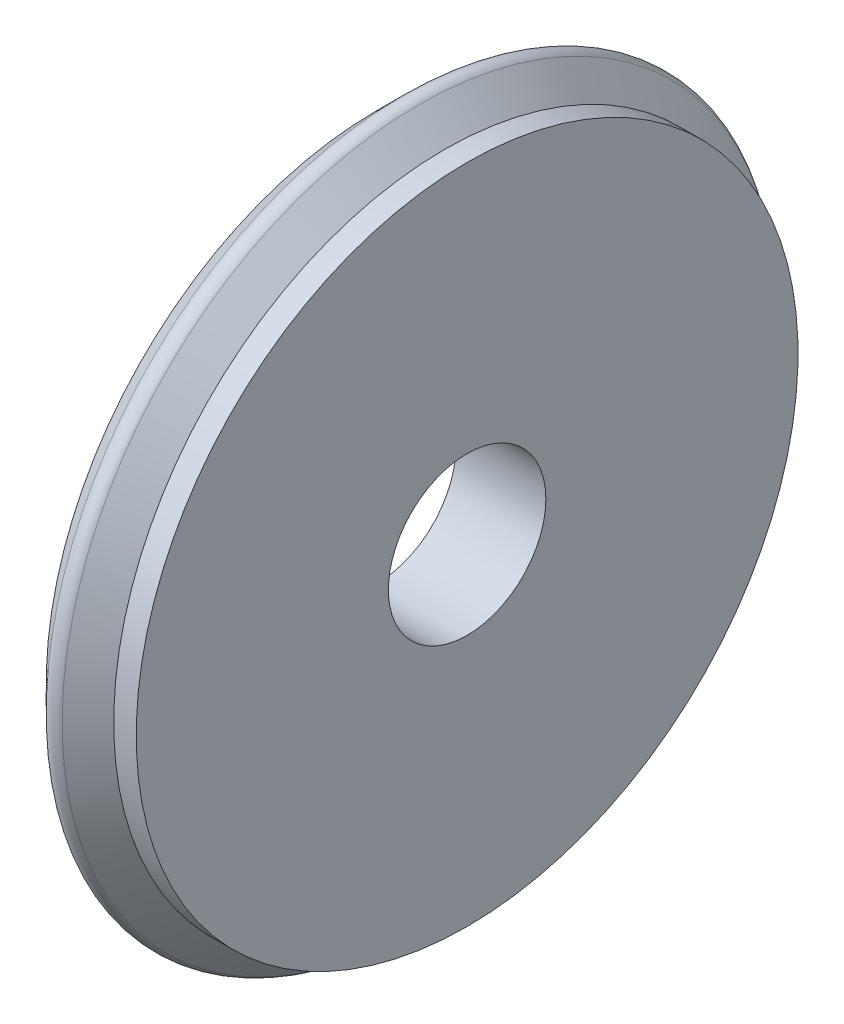
from build123d import *

# Parameters (mm, degrees)
ESQUISSE6_W = 4
ESQUISSE6_H = 3.5


with BuildPart() as part:
    # Esquisse1 → Révolution1 (revolve)
    with BuildSketch(Plane.XY, mode=Mode.PRIVATE) as r_volution1_sk:
        with BuildLine():
            Line((0, 0), (0, 14.707106781))
            Line((0, 14.707106781), (1.146446609, 15.853553391))
            ThreePointArc((1.146446609, 15.853553391), (1.5, 16), (1.853553391, 15.853553391))
            Line((1.853553391, 15.853553391), (3, 14.707106781))
            Line((3, 14.707106781), (4, 14.707106781))
            Line((4, 14.707106781), (4, 0))
            Line((4, 0), (0, 0))
        make_face()
    revolve(r_volution1_sk.sketch.rotate(Axis((0, 0, 0), (1, 0, 0)), 180), axis=Axis((0, 0, 0), (1, 0, 0)))

    # Esquisse6 → Enlèvement de matière-Révolution1 (revolve, cut)
    with BuildSketch(Plane.XY, mode=Mode.PRIVATE) as enl_vement_de_mati_re_r_volution1_sk:
        with Locations((2, 1.75)):
            Rectangle(ESQUISSE6_W, ESQUISSE6_H)
    revolve(enl_vement_de_mati_re_r_volution1_sk.sketch.rotate(Axis((4, 0, 0), (-1, 0, 0)), 90), axis=Axis((4, 0, 0), (-1, 0, 0)), mode=Mode.SUBTRACT)


solid = part.part
